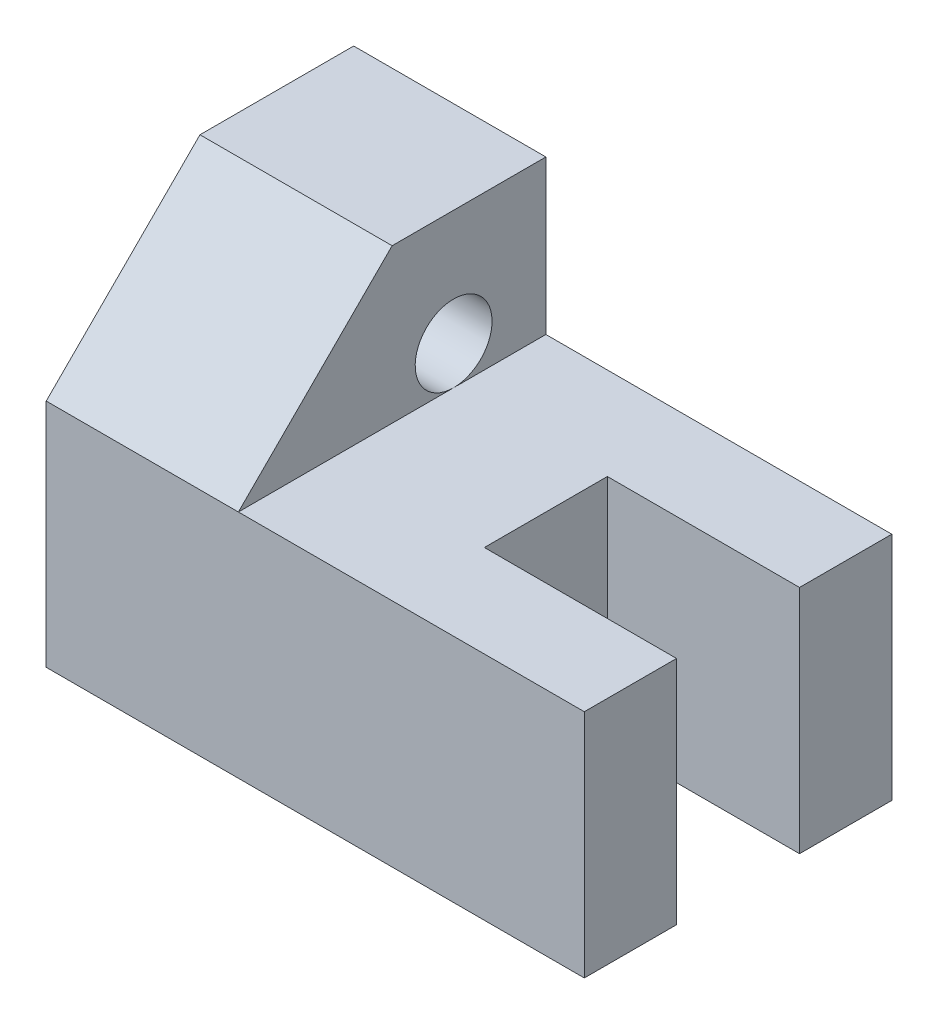
from build123d import *

# Parameters (mm, degrees)
SKETCH_1_W          = 70
SKETCH_1_H          = 40
EXTRUDE_1_DEPTH     = 30
SKETCH_6_W          = 25
SKETCH_6_H          = 16
CUT_EXTRUDE_2_DEPTH = 87.02325267
EXTRUDE_6_DEPTH     = 25
SKETCH_10_R         = 5
CUT_EXTRUDE_4_DEPTH = 95.868329805


with BuildPart() as part:
    # 草图1 → 凸台-拉伸1 (new body)
    with BuildSketch(Plane(origin=(0, 0, 0), x_dir=(1, 0, 0), z_dir=(0, 1, 0))):
        with Locations((35, -20)):
            Rectangle(SKETCH_1_W, SKETCH_1_H)
    extrude(amount=EXTRUDE_1_DEPTH)

    # 草图6 → 切除-拉伸2 (cut, through all)
    with BuildSketch(Plane(origin=(0, 30, 0), x_dir=(1, 0, 0), z_dir=(0, 1, 0))):
        with Locations((57.5, -20)):
            Rectangle(SKETCH_6_W, SKETCH_6_H)
    extrude(amount=-CUT_EXTRUDE_2_DEPTH, mode=Mode.SUBTRACT)

    # 草图9 → 凸台-拉伸6 (add)
    with BuildSketch(Plane(origin=(0, 0, 0), x_dir=(0, 0, -1), z_dir=(1, 0, 0))):
        Polygon((0, 0), (-40, 0), (-40, 30), (-20, 50), (0, 50), align=None)
    extrude(amount=EXTRUDE_6_DEPTH)

    # 草图10 → 切除-拉伸4 (cut, through all)
    with BuildSketch(Plane(origin=(0, 0, 0), x_dir=(0, 0, -1), z_dir=(1, 0, 0))):
        with Locations(Location((-12, 35, 0), (0, 0, 270))):
            Circle(SKETCH_10_R)
    extrude(amount=CUT_EXTRUDE_4_DEPTH, mode=Mode.SUBTRACT)


solid = part.part
